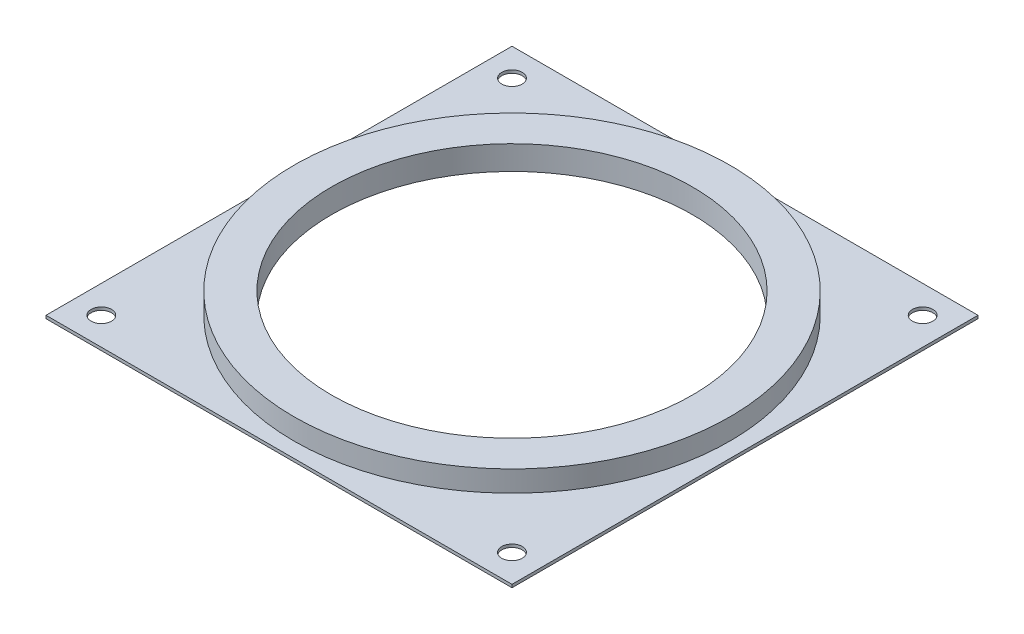
from build123d import *

# Parameters (mm, degrees)
SKETCH1_W           = 155
SKETCH1_H           = 155
SKETCH1_R           = 60
SKETCH1_R_2         = 3.4
BOSS_EXTRUDE1_DEPTH = 1
SKETCH2_R           = 72.5
SKETCH2_R_2         = 60
BOSS_EXTRUDE2_DEPTH = 7


with BuildPart() as part:
    # Sketch1 → Boss-Extrude1 (new body)
    with BuildSketch(Plane(origin=(0, 0, 0), x_dir=(1, 0, 0), z_dir=(0, 1, 0))):
        Rectangle(SKETCH1_W, SKETCH1_H)
        with Locations(Location((0, 0, 0), (0, 0, 270))):
            Circle(SKETCH1_R, mode=Mode.SUBTRACT)
        with Locations(Location((-68.3, 68.3, 0), (0, 0, 270))):
            Circle(SKETCH1_R_2, mode=Mode.SUBTRACT)
        with Locations(Location((68.3, 68.3, 0), (0, 0, 90))):
            Circle(SKETCH1_R_2, mode=Mode.SUBTRACT)
        with Locations(Location((-68.3, -68.3, 0), (0, 0, 90))):
            Circle(SKETCH1_R_2, mode=Mode.SUBTRACT)
        with Locations(Location((68.3, -68.3, 0), (0, 0, 270))):
            Circle(SKETCH1_R_2, mode=Mode.SUBTRACT)
    extrude(amount=BOSS_EXTRUDE1_DEPTH)

    # Sketch2 → Boss-Extrude2 (add)
    with BuildSketch(Plane(origin=(0, 1, 0), x_dir=(1, 0, 0), z_dir=(0, 1, 0))):
        with Locations(Location((0, 0, 0), (0, 0, 270))):
            Circle(SKETCH2_R)
        with Locations(Location((0, 0, 0), (0, 0, 270))):
            Circle(SKETCH2_R_2, mode=Mode.SUBTRACT)
    extrude(amount=BOSS_EXTRUDE2_DEPTH)


solid = part.part
